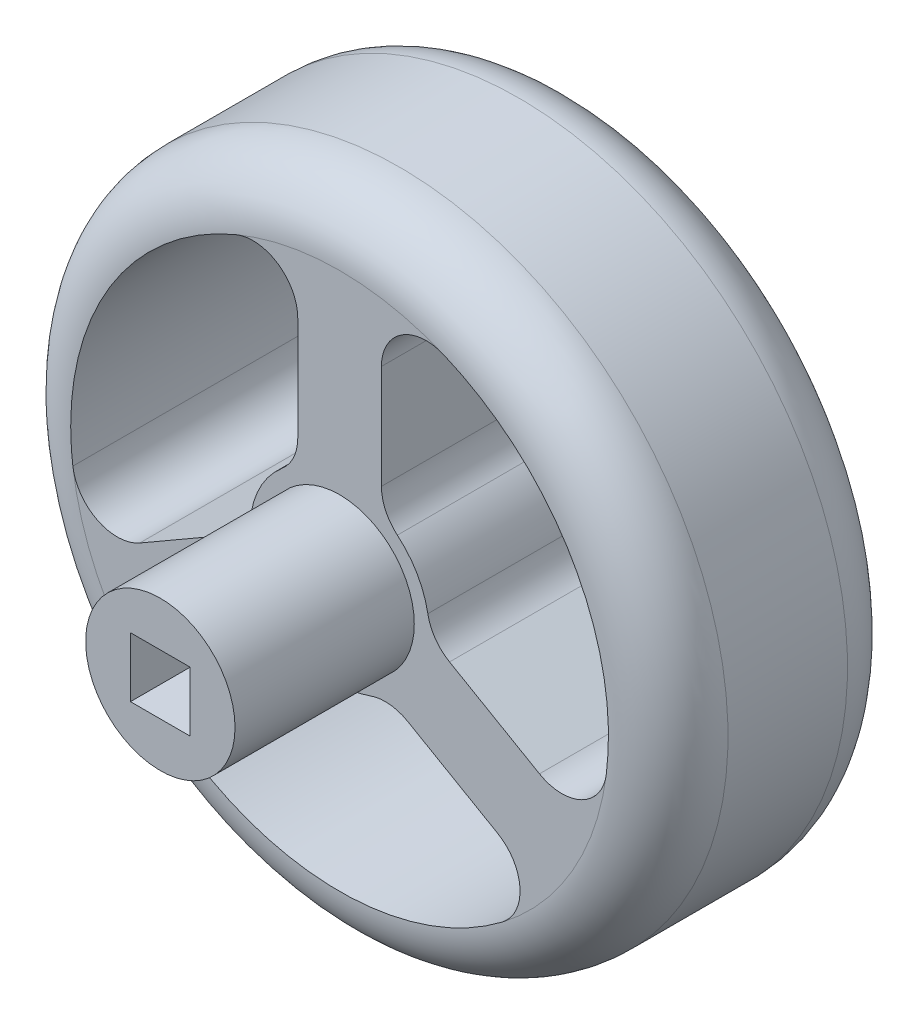
from build123d import *

# Parameters (mm, degrees)
SKETCH1_R           = 27.94
BOSS_EXTRUDE1_DEPTH = 20.32
SKETCH2_R           = 6.35
BOSS_EXTRUDE2_DEPTH = 20.32
BOSS_EXTRUDE3_START = 20.32
SKETCH3_R           = 27.94
BOSS_EXTRUDE3_DEPTH = 20.32
FILLET1_R           = 5.08
FILLET2_R           = 5.08
FILLET3_R           = 5.08
FILLET4_R           = 5.08
CUT_EXTRUDE1_DEPTH  = 73.645776241
SKETCH6_R           = 27.94
CUT_EXTRUDE2_DEPTH  = 57.682420605
SKETCH7_R           = 6.35
CUT_EXTRUDE3_DEPTH  = 5.08
SKETCH8_W           = 5.08
SKETCH8_H           = 5.08
CUT_EXTRUDE4_DEPTH  = 12.7


with BuildPart() as part:
    # Sketch1 → Boss-Extrude1 (new body)
    with BuildSketch(Plane.XY):
        Circle(SKETCH1_R)
    extrude(amount=BOSS_EXTRUDE1_DEPTH)

    # Sketch2 → Boss-Extrude2 (add)
    with BuildSketch(Plane(origin=(0, 0, 0), x_dir=(-1, 0, 0), z_dir=(0, 0, -1))):
        with Locations(Location((0, 0, 0), (0, 0, 180))):
            Circle(SKETCH2_R)
    extrude(amount=BOSS_EXTRUDE2_DEPTH)

    # Sketch3 → Boss-Extrude3 (add)
    with BuildSketch(Plane(origin=(0, 0, -20.32), x_dir=(-1, 0, 0), z_dir=(0, 0, -1)).offset(BOSS_EXTRUDE3_START)):
        with Locations(Location((0, 0, 0), (0, 0, 180))):
            Circle(SKETCH3_R)
    extrude(amount=-BOSS_EXTRUDE3_DEPTH)

    # Fillet1
    fillet1_edges = [part.edges().sort_by_distance(p)[0] for p in [
        (-27.94, 0, 20.32),
    ]]
    fillet(fillet1_edges, radius=FILLET1_R)

    # Fillet2
    fillet2_edges = [part.edges().sort_by_distance(p)[0] for p in [
        (-27.94, 0, 0),
    ]]
    fillet(fillet2_edges, radius=FILLET2_R)

    # Fillet3
    fillet3_edges = [part.edges().sort_by_distance(p)[0] for p in [
        (-27.94, 0, -20.32),
    ]]
    fillet(fillet3_edges, radius=FILLET3_R)

    # Fillet4
    fillet4_edges = [part.edges().sort_by_distance(p)[0] for p in [
        (-27.94, 0, -40.64),
    ]]
    fillet(fillet4_edges, radius=FILLET4_R)

    # Sketch4 → Cut-Extrude1 (cut, through all)
    with BuildSketch(Plane(origin=(0, 0, -40.64), x_dir=(-1, 0, 0), z_dir=(0, 0, -1))):
        with BuildLine():
            Line((-3.556, 8.739962471), (-3.556, 17.568282329))
            ThreePointArc((-3.556, 17.568282329), (-5.256117539, 20.740741312), (-8.8392, 21.081938795))
            ThreePointArc((-8.8392, 21.081938795), (-19.797340731, 11.43), (-22.677094558, -2.885997648))
            ThreePointArc((-22.677094558, -2.885997648), (-20.590067639, -5.818439342), (-16.992578798, -5.704554829))
            Line((-16.992578798, -5.704554829), (-9.347029528, -1.2903949))
            ThreePointArc((-9.347029528, -1.2903949), (-8.133427478, -0.179541209), (-7.501353019, 1.339441259))
            ThreePointArc((-7.501353019, 1.339441259), (-6.599113577, 3.81), (-4.910666667, 5.826641648))
            ThreePointArc((-4.910666667, 5.826641648), (-3.911226491, 7.13352542), (-3.556, 8.739962471))
        make_face()
        with BuildLine():
            Line((3.556, 8.739962471), (3.556, 17.568282329))
            ThreePointArc((3.556, 17.568282329), (5.256117539, 20.740741312), (8.8392, 21.081938795))
            ThreePointArc((8.8392, 21.081938795), (19.797340731, 11.43), (22.677094558, -2.885997648))
            ThreePointArc((22.677094558, -2.885997648), (20.590067639, -5.818439342), (16.992578798, -5.704554829))
            Line((16.992578798, -5.704554829), (9.347029528, -1.2903949))
            ThreePointArc((9.347029528, -1.2903949), (8.133427478, -0.179541209), (7.501353019, 1.339441259))
            ThreePointArc((7.501353019, 1.339441259), (6.599113577, 3.81), (4.910666667, 5.826641648))
            ThreePointArc((4.910666667, 5.826641648), (3.911226491, 7.13352542), (3.556, 8.739962471))
        make_face()
        with BuildLine():
            Line((5.791029528, -7.449567572), (13.436578798, -11.8637275))
            ThreePointArc((13.436578798, -11.8637275), (15.3339501, -14.92230197), (13.837894558, -18.195941147))
            ThreePointArc((13.837894558, -18.195941147), (0, -22.86), (-13.837894558, -18.195941147))
            ThreePointArc((-13.837894558, -18.195941147), (-15.3339501, -14.92230197), (-13.436578798, -11.8637275))
            Line((-13.436578798, -11.8637275), (-5.791029528, -7.449567572))
            ThreePointArc((-5.791029528, -7.449567572), (-4.222200987, -6.953984211), (-2.590686352, -7.166082907))
            ThreePointArc((-2.590686352, -7.166082907), (0, -7.62), (2.590686352, -7.166082907))
            ThreePointArc((2.590686352, -7.166082907), (4.222200987, -6.953984211), (5.791029528, -7.449567572))
        make_face()
    extrude(amount=-CUT_EXTRUDE1_DEPTH, mode=Mode.SUBTRACT)

    # Sketch6 → Cut-Extrude2 (cut, through all)
    with BuildSketch(Plane(origin=(0, 0, 0), x_dir=(-1, 0, 0), z_dir=(0, 0, -1))):
        Circle(SKETCH6_R)
    extrude(amount=-CUT_EXTRUDE2_DEPTH, mode=Mode.SUBTRACT)

    # Sketch7 → Cut-Extrude3 (cut)
    with BuildSketch(Plane.XY):
        Circle(SKETCH7_R)
    extrude(amount=-CUT_EXTRUDE3_DEPTH, mode=Mode.SUBTRACT)

    # Sketch8 → Cut-Extrude4 (cut)
    with BuildSketch(Plane.XY.offset(-5.08)):
        Rectangle(SKETCH8_W, SKETCH8_H)
    extrude(amount=-CUT_EXTRUDE4_DEPTH, mode=Mode.SUBTRACT)


solid = part.part
